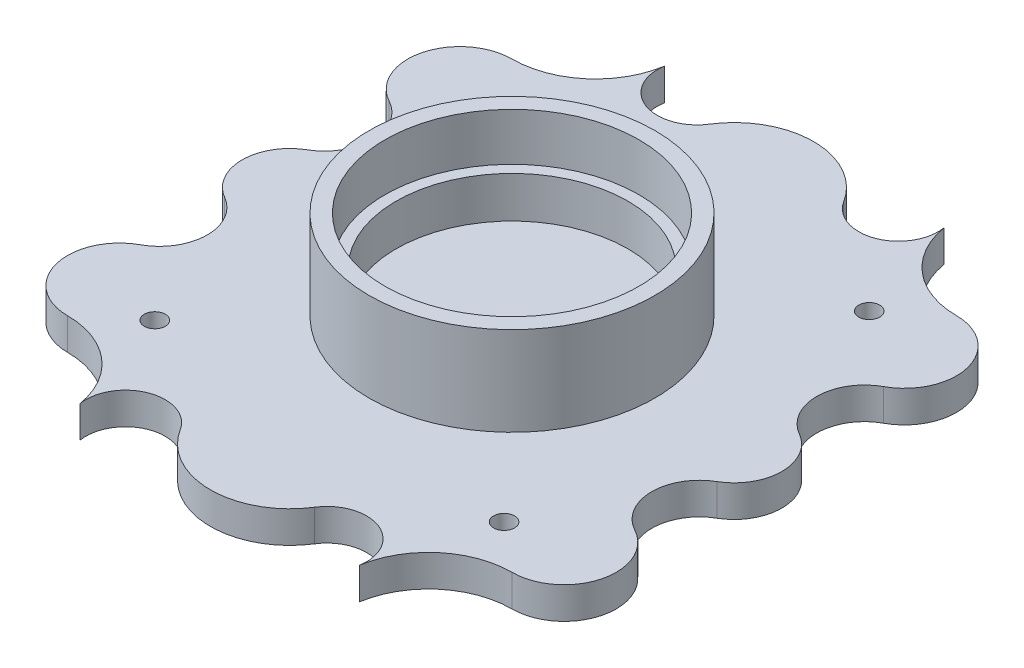
from build123d import *

# Parameters (mm, degrees)
SALIENTE_EXTRUIR1_DEPTH                              = 10
SALIENTE_EXTRUIR2_DEPTH                              = 10
CROQUIS3_R                                           = 40
CROQUIS3_R_2                                         = 36.5
SALIENTE_EXTRUIR3_DEPTH                              = 13
CROQUIS4_R                                           = 45
CROQUIS4_R_2                                         = 40
SALIENTE_EXTRUIR4_DEPTH                              = 28
REFRENTADO_PARA_TORNILLO_CON_CABEZA_HUEC_D           = 6.6
REFRENTADO_PARA_TORNILLO_CON_CABEZA_HUEC_CBORE_D     = 11
REFRENTADO_PARA_TORNILLO_CON_CABEZA_HUEC_CBORE_DEPTH = 4.6


with BuildPart() as part:
    # Croquis1 → Saliente-Extruir1 (new body)
    with BuildSketch(Plane(origin=(0, 0, 0), x_dir=(1, 0, 0), z_dir=(0, 1, 0))):
        with BuildLine():
            Line((-70, -70), (-70, 70))
            ThreePointArc((-70, 70), (-52.983030462, 76.249658661), (-44.055908755, 92.027554074))
            ThreePointArc((-44.055908755, 92.027554074), (-36.156795126, 78.313355526), (-21.147629234, 83.333333333))
            ThreePointArc((-21.147629234, 83.333333333), (0, 95), (21.147629234, 83.333333333))
            ThreePointArc((21.147629234, 83.333333333), (36.156795126, 78.313355526), (44.055908755, 92.027554074))
            ThreePointArc((44.055908755, 92.027554074), (52.983030462, 76.249658661), (70, 70))
            Line((70, 70), (70, -70))
            ThreePointArc((70, -70), (52.983030462, -76.249658661), (44.055908755, -92.027554074))
            ThreePointArc((44.055908755, -92.027554074), (36.156795126, -78.313355526), (21.147629234, -83.333333333))
            ThreePointArc((21.147629234, -83.333333333), (0, -95), (-21.147629234, -83.333333333))
            ThreePointArc((-21.147629234, -83.333333333), (-36.156795126, -78.313355526), (-44.055908755, -92.027554074))
            ThreePointArc((-44.055908755, -92.027554074), (-52.983030462, -76.249658661), (-70, -70))
        make_face()
    extrude(amount=SALIENTE_EXTRUIR1_DEPTH)

    # Croquis2 → Saliente-Extruir2 (add)
    with BuildSketch(Plane(origin=(0, 10, 0), x_dir=(1, 0, 0), z_dir=(0, 1, 0))):
        with BuildLine():
            Line((-70, 25.98076189), (-70, 70))
            ThreePointArc((-70, 70), (-85.909969357, 57.627811916), (-77.837993487, 39.160506523))
            ThreePointArc((-77.837993487, 39.160506523), (-72.107558403, 33.647896498), (-70, 25.98076189))
        make_face()
        with BuildLine():
            ThreePointArc((77.837993487, 39.160506523), (85.909969357, 57.627811916), (70, 70))
            Line((70, 70), (70, 25.98076213))
            ThreePointArc((70, 25.98076213), (72.107558465, 33.647896602), (77.837993487, 39.160506523))
        make_face()
        with BuildLine():
            ThreePointArc((77.5, 12.990381057), (72.009618939, 18.480762121), (70, 25.98076213))
            Line((70, 25.98076213), (70, -25.98076213))
            ThreePointArc((70, -25.98076213), (72.009618939, -18.480762121), (77.5, -12.990381057))
            ThreePointArc((77.5, -12.990381057), (85, 0), (77.5, 12.990381057))
        make_face()
        with BuildLine():
            Line((-70, -25.980762199), (-70, 25.98076189))
            ThreePointArc((-70, 25.98076189), (-72.009618999, 18.480762017), (-77.5, 12.990381057))
            ThreePointArc((-77.5, 12.990381057), (-85, 0), (-77.5, -12.990381057))
            ThreePointArc((-77.5, -12.990381057), (-72.009618922, -18.480762151), (-70, -25.980762199))
        make_face()
        with BuildLine():
            Line((-70, -70), (-70, -25.980762199))
            ThreePointArc((-70, -25.980762199), (-72.107558482, -33.647896631), (-77.837993487, -39.160506523))
            ThreePointArc((-77.837993487, -39.160506523), (-85.909969357, -57.627811916), (-70, -70))
        make_face()
        with BuildLine():
            ThreePointArc((77.837993487, -39.160506523), (72.107558465, -33.647896602), (70, -25.98076213))
            Line((70, -25.98076213), (70, -70))
            ThreePointArc((70, -70), (85.909969357, -57.627811916), (77.837993487, -39.160506523))
        make_face()
    extrude(amount=-SALIENTE_EXTRUIR2_DEPTH)

    # Croquis3 → Saliente-Extruir3 (add)
    with BuildSketch(Plane(origin=(0, 10, 0), x_dir=(1, 0, 0), z_dir=(0, 1, 0))):
        with Locations(Location((0, 0, 0), (0, 0, 90))):
            Circle(CROQUIS3_R)
        with Locations(Location((0, 0, 0), (0, 0, 90))):
            Circle(CROQUIS3_R_2, mode=Mode.SUBTRACT)
    extrude(amount=SALIENTE_EXTRUIR3_DEPTH)

    # Croquis4 → Saliente-Extruir4 (add)
    with BuildSketch(Plane(origin=(0, 10, 0), x_dir=(1, 0, 0), z_dir=(0, 1, 0))):
        with Locations(Location((0, 0, 0), (0, 0, 270))):
            Circle(CROQUIS4_R)
        with Locations(Location((0, 0, 0), (0, 0, 270))):
            Circle(CROQUIS4_R_2, mode=Mode.SUBTRACT)
    extrude(amount=SALIENTE_EXTRUIR4_DEPTH)

    # Refrentado para tornillo con cabeza hueca hexagonal de M61 (through all)
    with Locations(Plane(origin=(-55, 0, 57.5), x_dir=(0, 0, -1), z_dir=(0, -1, 0))):
        with Locations((0, 0), (0, 110), (115, 110), (115, 0)):
            CounterBoreHole(REFRENTADO_PARA_TORNILLO_CON_CABEZA_HUEC_D / 2, REFRENTADO_PARA_TORNILLO_CON_CABEZA_HUEC_CBORE_D / 2, REFRENTADO_PARA_TORNILLO_CON_CABEZA_HUEC_CBORE_DEPTH)


solid = part.part
